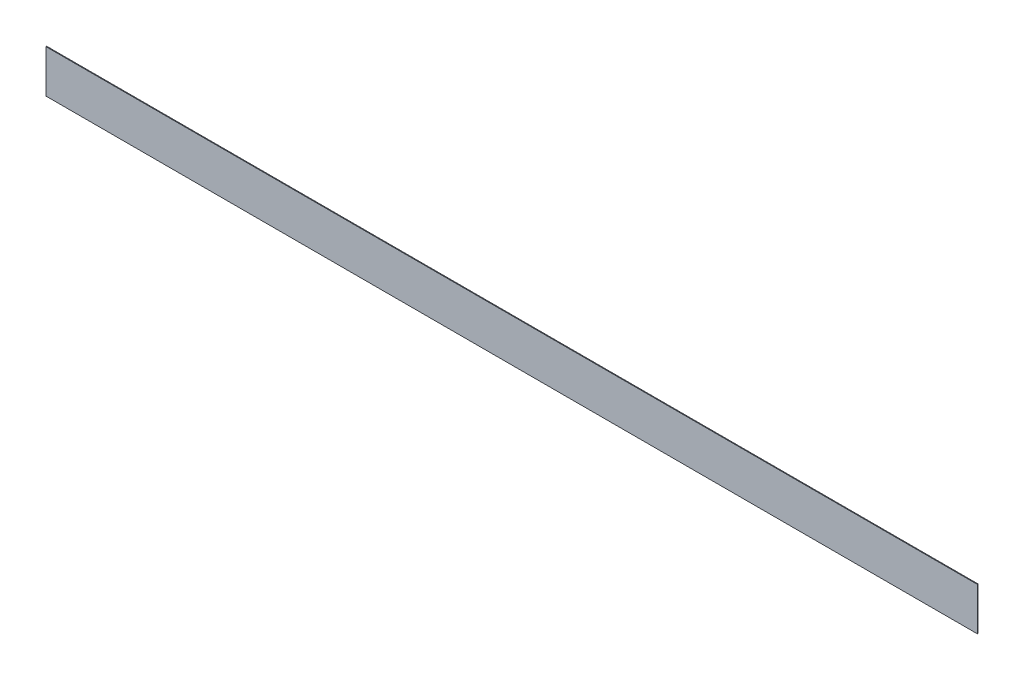
from build123d import *

# Parameters (mm, degrees)
SKETCH1_W           = 2500
SKETCH1_H           = 115
BOSS_EXTRUDE1_DEPTH = 2


with BuildPart() as part:
    # Sketch1 → Boss-Extrude1 (new body)
    with BuildSketch(Plane.XY):
        with Locations((1250, 57.5)):
            Rectangle(SKETCH1_W, SKETCH1_H)
    extrude(amount=BOSS_EXTRUDE1_DEPTH)


solid = part.part
